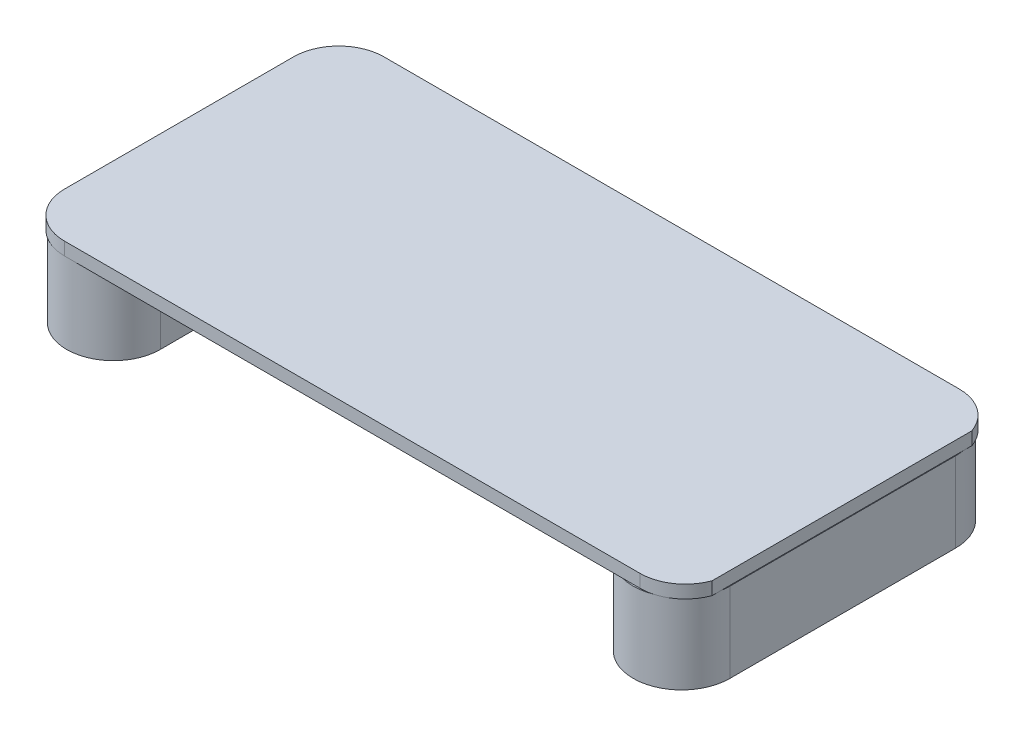
from build123d import *

# Parameters (mm, degrees)
BOSS_EXTRUDE1_DEPTH = 4.5
BOSS_EXTRUDE2_DEPTH = 3.8
BOSS_EXTRUDE3_DEPTH = 12.4
SKETCH5_W           = 103.25
SKETCH5_H           = 49.520314098
BOSS_EXTRUDE4_DEPTH = 2
FILLET1_R           = 7
SKETCH6_W           = 74.836382047
SKETCH6_H           = 26.769621583
CUT_EXTRUDE1_DEPTH  = 0.42
SKETCH7_W           = 32.821875261
SKETCH7_H           = 64.99782183
CUT_EXTRUDE4_DEPTH  = 8.3
BOSS_EXTRUDE5_DEPTH = 12.4


with BuildPart() as part:
    # Sketch1 → Boss-Extrude1 (new body)
    with BuildSketch(Plane(origin=(0, 0, 0), x_dir=(1, 0, 0), z_dir=(0, 1, 0))):
        with BuildLine():
            Line((7.25, 0), (7.25, -35))
            ThreePointArc((7.25, -35), (0, -42.25), (-7.25, -35))
            Line((-7.25, -35), (-7.25, 0))
            ThreePointArc((-7.25, 0), (0, 7.25), (7.25, 0))
        make_face()
    extrude(amount=BOSS_EXTRUDE1_DEPTH)

    # Sketch3 → Boss-Extrude2 (add)
    with BuildSketch(Plane(origin=(0, 4.5, 0), x_dir=(1, 0, 0), z_dir=(0, 1, 0))):
        with BuildLine():
            Line((-2.622571491, -0.457666807), (-2.622571491, -35.011296081))
            ThreePointArc((-2.622571491, -35.011296081), (0.070610389, -37.704477961), (2.763792269, -35.011296081))
            Line((2.763792269, -35.011296081), (2.763792269, -0.457666807))
            ThreePointArc((2.763792269, -0.457666807), (0.070610389, 2.718626164), (-2.622571491, -0.457666807))
        make_face()
    extrude(amount=BOSS_EXTRUDE2_DEPTH)

    # Sketch4 → Boss-Extrude3 (add)
    with BuildSketch(Plane(origin=(0, 8.3, 0), x_dir=(1, 0, 0), z_dir=(0, 1, 0))):
        with BuildLine():
            Line((7.25308141, 0.014627933), (7.323691799, -34.996668148))
            ThreePointArc((7.323691799, -34.996668148), (0.085238322, -42.264377491), (-7.182471021, -35.025924014))
            Line((-7.182471021, -35.025924014), (-7.25308141, -0.014627933))
            ThreePointArc((-7.25308141, -0.014627933), (-0.014627933, 7.25308141), (7.25308141, 0.014627933))
        make_face()
    extrude(amount=BOSS_EXTRUDE3_DEPTH)

    # Sketch5 → Boss-Extrude4 (add)
    with BuildSketch(Plane(origin=(0, 20.7, 0), x_dir=(1, 0, 0), z_dir=(0, 1, 0))):
        with Locations((44.371903839, -17.507075639)):
            Rectangle(SKETCH5_W, SKETCH5_H)
    extrude(amount=BOSS_EXTRUDE4_DEPTH)

    # Fillet1
    fillet1_edges = [part.edges().sort_by_distance(p)[0] for p in [
        (95.996903839, 21.7, 42.267232688),
        (95.996903839, 21.7, -7.25308141),
        (-7.253096161, 21.7, -7.25308141),
        (-7.253096161, 21.7, 42.267232688),
    ]]
    fillet(fillet1_edges, radius=FILLET1_R)

    # Sketch6 → Cut-Extrude1 (cut)
    with BuildSketch(Plane(origin=(95.996903839, 0, 0), x_dir=(0, 0, -1), z_dir=(1, 0, 0))):
        with Locations((-22.928368507, 17.221399119)):
            Rectangle(SKETCH6_W, SKETCH6_H)
    extrude(amount=-CUT_EXTRUDE1_DEPTH, mode=Mode.SUBTRACT)

    # Sketch7 → Cut-Extrude4 (cut)
    with BuildSketch(Plane.XZ):
        with Locations((-1.71559597, 16.327002209)):
            Rectangle(SKETCH7_W, SKETCH7_H)
    extrude(amount=-CUT_EXTRUDE4_DEPTH, mode=Mode.SUBTRACT)

    # Sketch9 → Boss-Extrude5 (add)
    with BuildSketch(Plane.XZ.offset(-20.7)):
        with BuildLine():
            Line((80.676554066, 0), (80.676554066, 35.01))
            ThreePointArc((80.676554066, 35.01), (88.176554066, 42.51), (95.676554066, 35.01))
            Line((95.676554066, 35.01), (95.676554066, 0))
            ThreePointArc((95.676554066, 0), (88.176554066, -7.5), (80.676554066, 0))
        make_face()
    extrude(amount=BOSS_EXTRUDE5_DEPTH)


solid = part.part
